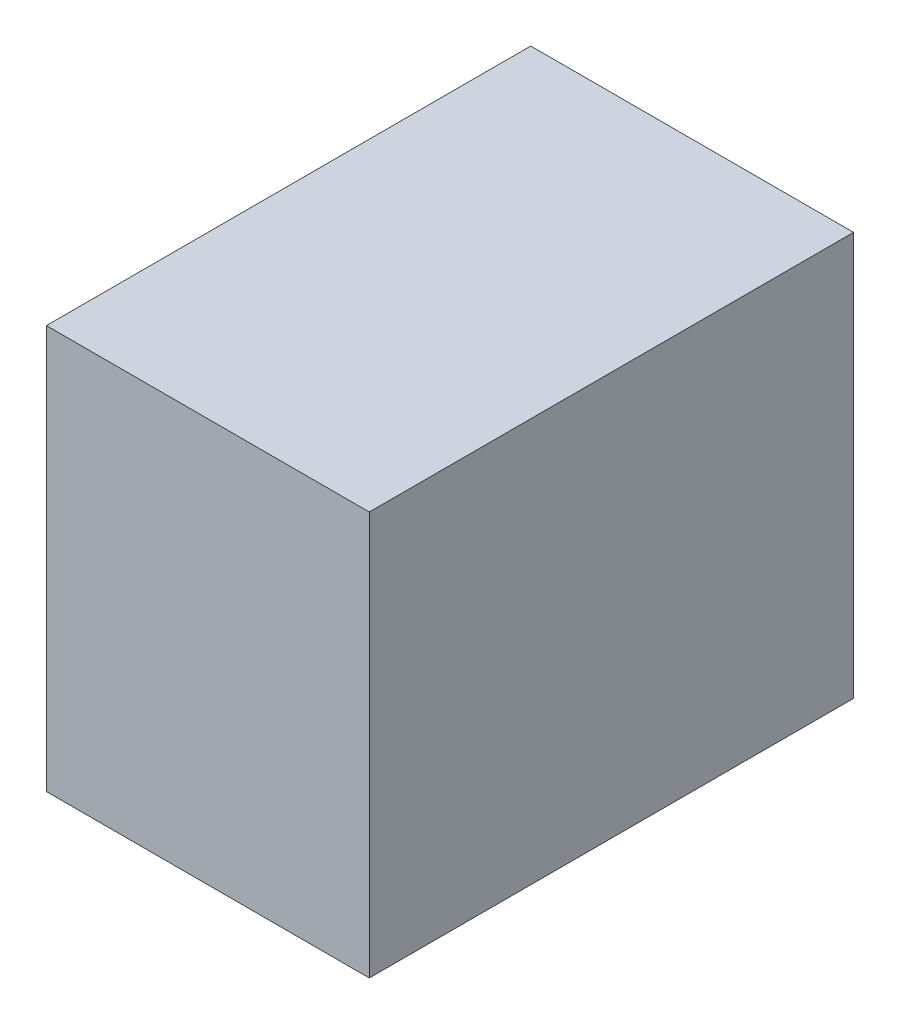
from build123d import *

# Parameters (mm, degrees)
PACK_VAKUM_SELENOID_TABAN_1_START = -620
SKETCH1_W                         = 40
SKETCH1_H                         = 50
PACK_VAKUM_SELENOID_TABAN_1_DEPTH = 60


with BuildPart() as part:
    # Sketch1 → PACK_vakum_selenoid_taban_1 (new body)
    with BuildSketch(Plane.XY.offset(PACK_VAKUM_SELENOID_TABAN_1_START)):
        with Locations((240, 345)):
            Rectangle(SKETCH1_W, SKETCH1_H)
    extrude(amount=-PACK_VAKUM_SELENOID_TABAN_1_DEPTH)


solid = part.part
